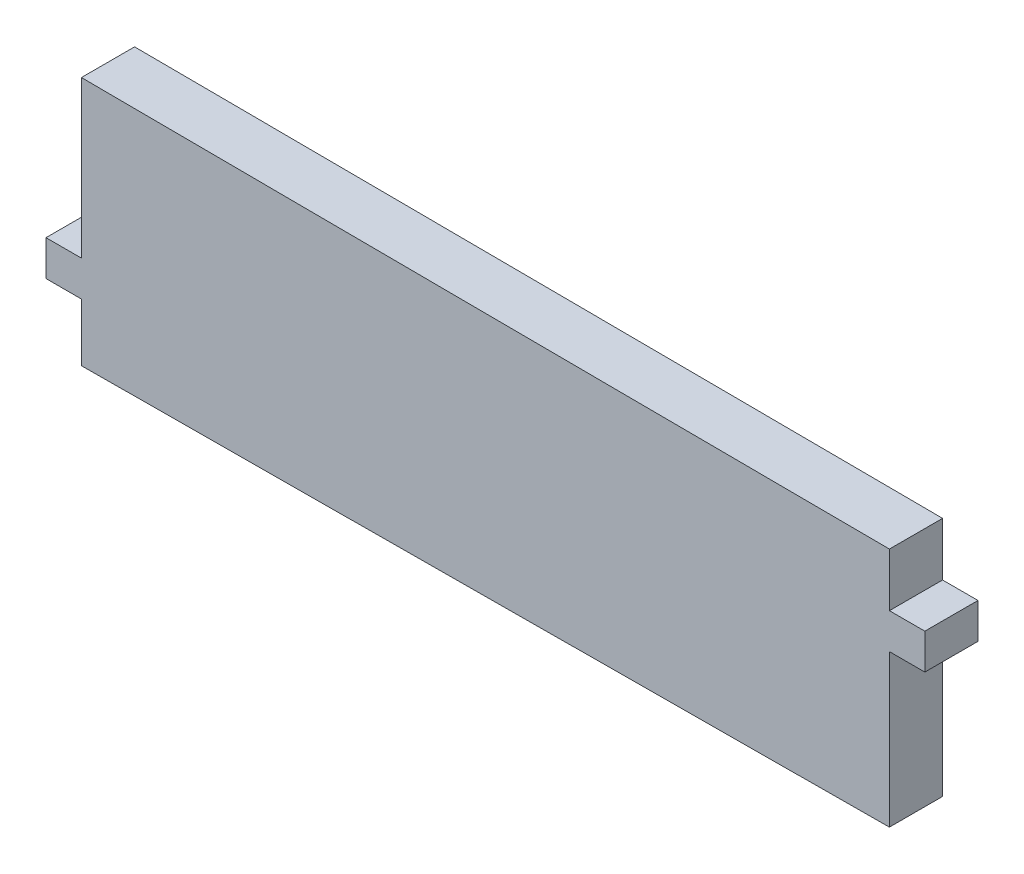
from build123d import *

# Parameters (mm, degrees)
BOSS_EXTRUDE1_DEPTH = 4.7625


with BuildPart() as part:
    # Sketch1 → Boss-Extrude1 (new body)
    with BuildSketch(Plane.XY):
        Polygon((84.671798958, -9.794927314), (81.496798958, -9.794927314), (81.496798958, -6.619927314), (84.671798958, -6.619927314), (84.671798958, 7.393124236), (157.061798958, 7.002202669), (157.061798958, 2.219272686), (160.236798958, 2.219272686), (160.236798958, -0.955727314), (157.061798958, -0.955727314), (157.061798958, -14.578026911), (84.671798958, -14.969304817), align=None)
    extrude(amount=BOSS_EXTRUDE1_DEPTH)


solid = part.part
